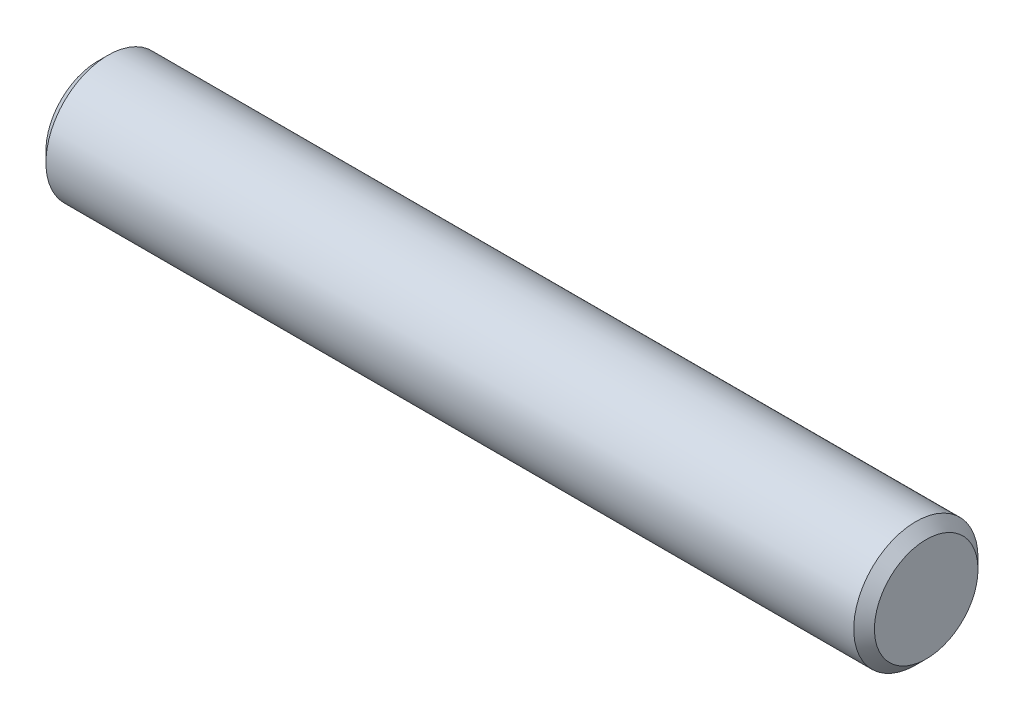
from build123d import *

# Parameters (mm, degrees)
SKETCH1_R           = 1.5
BOSS_EXTRUDE1_DEPTH = 10
CHAMFER1_SIZE       = 0.25


with BuildPart() as part:
    # Sketch1 → Boss-Extrude1 (new, symmetric)
    with BuildSketch(Plane(origin=(0, 0, 0), x_dir=(0, 0, -1), z_dir=(1, 0, 0))):
        Circle(SKETCH1_R)
    extrude(amount=BOSS_EXTRUDE1_DEPTH, both=True)

    # Chamfer1
    chamfer1_edges = [part.edges().sort_by_distance(p)[0] for p in [
        (-10, 0, 1.5),
        (10, 0, 1.5),
    ]]
    chamfer(chamfer1_edges, length=CHAMFER1_SIZE)


solid = part.part
